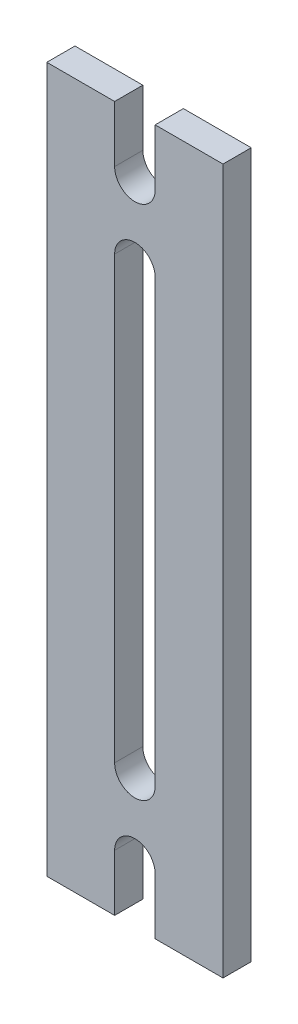
from build123d import *

# Parameters (mm, degrees)
SKETCH1_W           = 10
SKETCH1_H           = 40
BOSS_EXTRUDE1_DEPTH = 1.6
CUT_EXTRUDE1_DEPTH  = 21.67752403


with BuildPart() as part:
    # Sketch1 → Boss-Extrude1 (new body)
    with BuildSketch(Plane.XY):
        Rectangle(SKETCH1_W, SKETCH1_H)
    extrude(amount=BOSS_EXTRUDE1_DEPTH)

    # Sketch3 → Cut-Extrude1 (cut, through all)
    with BuildSketch(Plane.XY.offset(1.6)):
        with BuildLine():
            Line((1.15, 12.5), (1.15, -12.5))
            ThreePointArc((1.15, -12.5), (0, -13.65), (-1.15, -12.5))
            Line((-1.15, -12.5), (-1.15, 12.5))
            ThreePointArc((-1.15, 12.5), (0, 13.65), (1.15, 12.5))
        make_face()
        with BuildLine():
            Line((1.15, 41.8), (1.15, 16.8))
            ThreePointArc((1.15, 16.8), (0, 15.65), (-1.15, 16.8))
            Line((-1.15, 16.8), (-1.15, 41.8))
            ThreePointArc((-1.15, 41.8), (0, 42.95), (1.15, 41.8))
        make_face()
        with BuildLine():
            Line((1.15, -16.8), (1.15, -41.8))
            ThreePointArc((1.15, -41.8), (0, -42.95), (-1.15, -41.8))
            Line((-1.15, -41.8), (-1.15, -16.8))
            ThreePointArc((-1.15, -16.8), (0, -15.65), (1.15, -16.8))
        make_face()
    extrude(amount=-CUT_EXTRUDE1_DEPTH, mode=Mode.SUBTRACT)


solid = part.part
